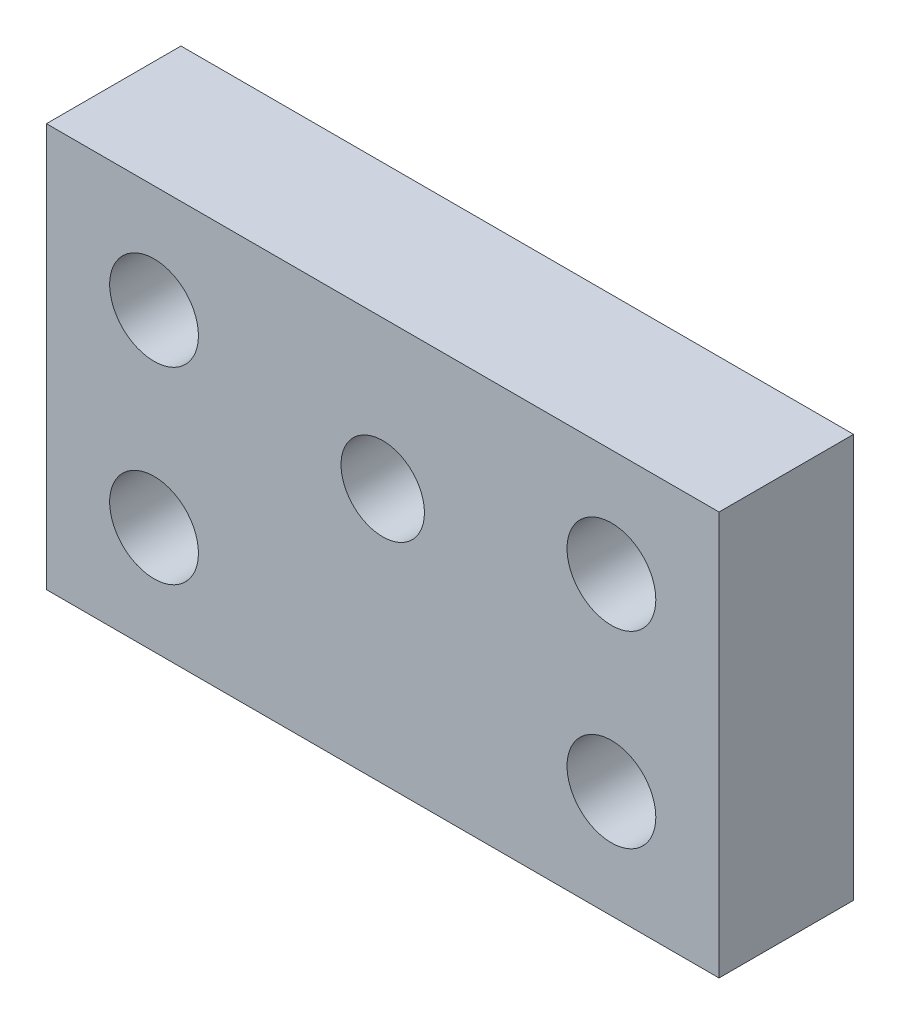
from build123d import *

# Parameters (mm, degrees)
SZKIC1_W                    = 25
SZKIC1_H                    = 15
SZKIC1_R                    = 1.65
DODANIE_WYCI_GNI_CIE1_DEPTH = 5
SZKIC2_R                    = 1.55
WYTNIJ_WYCI_GNI_CIE1_DEPTH  = 5


with BuildPart() as part:
    # Szkic1 → Dodanie-wyciągnięcie1 (new body)
    with BuildSketch(Plane.XY):
        with Locations((8.5, 3.5)):
            Rectangle(SZKIC1_W, SZKIC1_H)
        Circle(SZKIC1_R, mode=Mode.SUBTRACT)
        with Locations((0, 7)):
            Circle(SZKIC1_R, mode=Mode.SUBTRACT)
        with Locations((17, 0)):
            Circle(SZKIC1_R, mode=Mode.SUBTRACT)
        with Locations((17, 7)):
            Circle(SZKIC1_R, mode=Mode.SUBTRACT)
    extrude(amount=DODANIE_WYCI_GNI_CIE1_DEPTH)

    # Szkic2 → Wytnij-wyciągnięcie1 (cut)
    with BuildSketch(Plane.XY.offset(5)):
        with Locations((8.5, 5.5)):
            Circle(SZKIC2_R)
    extrude(amount=-WYTNIJ_WYCI_GNI_CIE1_DEPTH, mode=Mode.SUBTRACT)


solid = part.part
